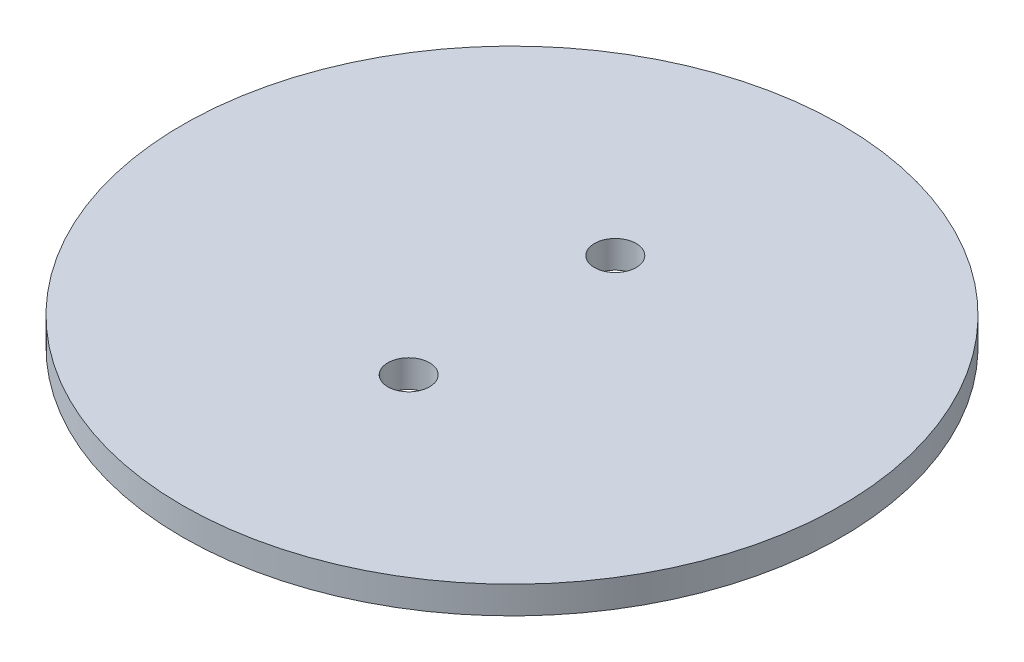
from build123d import *

# Parameters (mm, degrees)
SKETCH1_R           = 76.1746
BOSS_EXTRUDE1_DEPTH = 6.35
SKETCH2_R           = 4.826
CUT_EXTRUDE1_DEPTH  = 18.796


with BuildPart() as part:
    # Sketch1 → Boss-Extrude1 (new body)
    with BuildSketch(Plane(origin=(0, 0, 0), x_dir=(1, 0, 0), z_dir=(0, 1, 0))):
        with Locations(Location((0, 0, 0), (0, 0, 270))):
            Circle(SKETCH1_R)
    extrude(amount=BOSS_EXTRUDE1_DEPTH)

    # Sketch2 → Cut-Extrude1 (cut)
    with BuildSketch(Plane(origin=(0, 6.35, 0), x_dir=(1, 0, 0), z_dir=(0, 1, 0))):
        with Locations(Location((0, 23.876, 0), (0, 0, 270))):
            Circle(SKETCH2_R)
        with Locations(Location((0, -23.876, 0), (0, 0, 270))):
            Circle(SKETCH2_R)
    extrude(amount=-CUT_EXTRUDE1_DEPTH, mode=Mode.SUBTRACT)


solid = part.part
